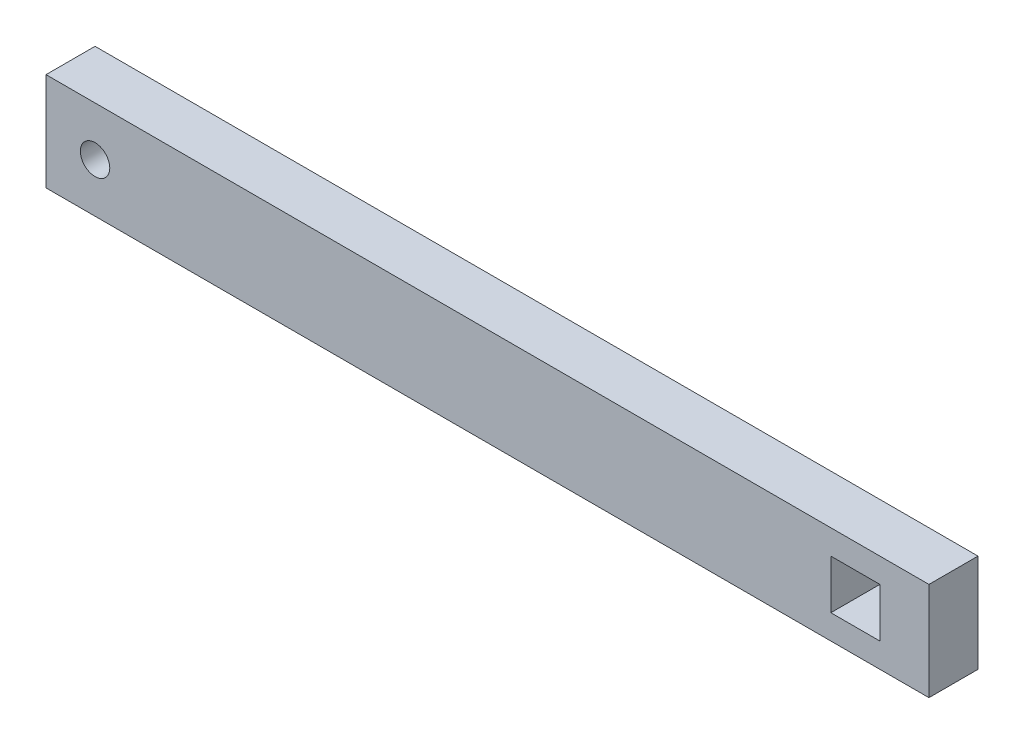
from build123d import *

# Parameters (mm, degrees)
ESQUISSE1_W        = 90
ESQUISSE1_H        = 10
ESQUISSE1_R        = 1.5
ESQUISSE1_W_2      = 5
ESQUISSE1_H_2      = 5
BOSS_EXTRU_1_DEPTH = 5


with BuildPart() as part:
    # Esquisse1 → Boss.-Extru.1 (new body)
    with BuildSketch(Plane.XY):
        with Locations((45, 5)):
            Rectangle(ESQUISSE1_W, ESQUISSE1_H)
        with Locations((5, 5)):
            Circle(ESQUISSE1_R, mode=Mode.SUBTRACT)
        with Locations((82.5, 5)):
            Rectangle(ESQUISSE1_W_2, ESQUISSE1_H_2, mode=Mode.SUBTRACT)
    extrude(amount=BOSS_EXTRU_1_DEPTH)


solid = part.part
